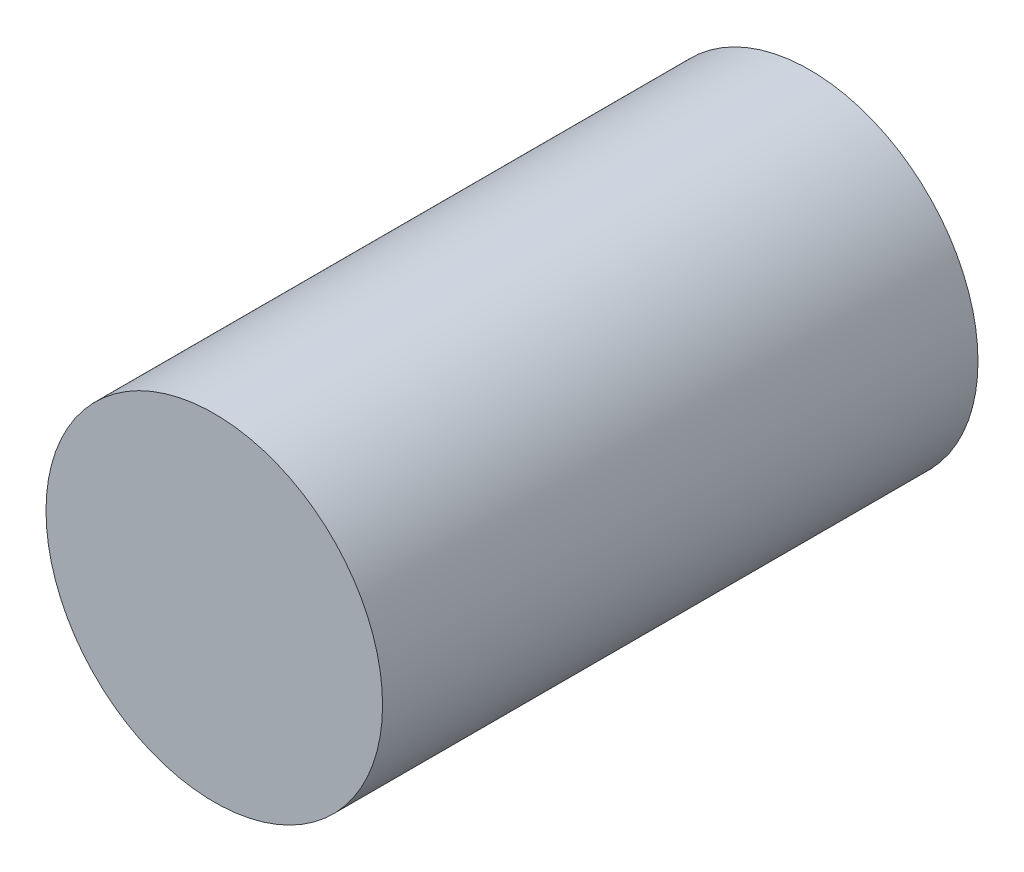
from build123d import *

# Parameters (mm, degrees)
SKETCH2_R           = 3.9
BOSS_EXTRUDE1_DEPTH = 13.8


with BuildPart() as part:
    # Sketch2 → Boss-Extrude1 (new body)
    with BuildSketch(Plane.XY):
        with Locations(Location((0, 0, 0), (0, 0, 180))):
            Circle(SKETCH2_R)
    extrude(amount=BOSS_EXTRUDE1_DEPTH)


solid = part.part
